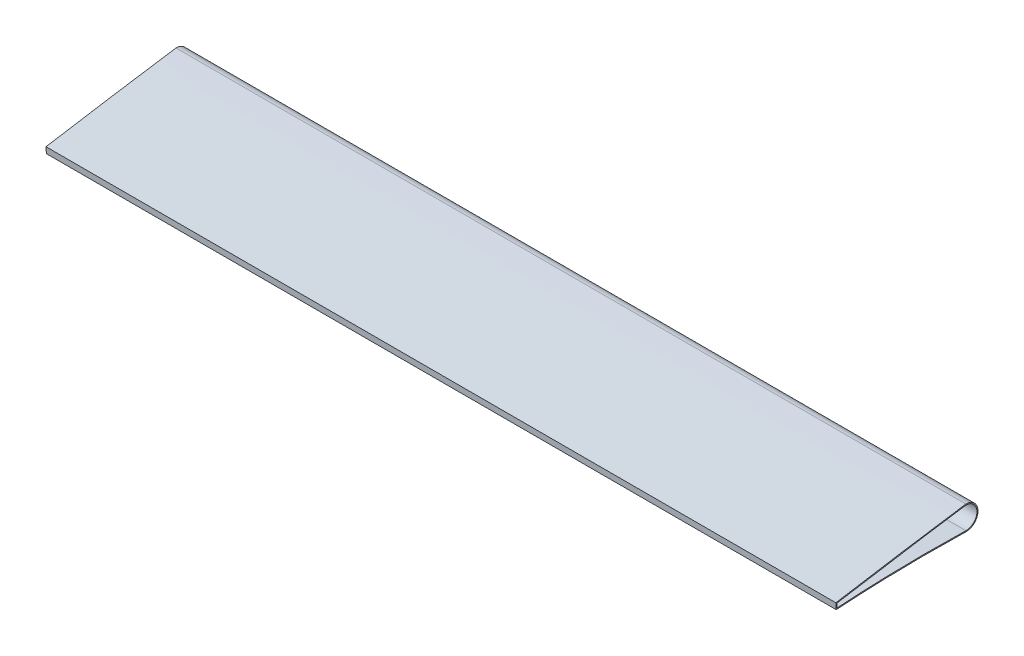
from build123d import *

# Parameters (mm, degrees)
SCHIZZO1_R               = 1.65
CORPOFOAM_DEPTH          = 225
SCHIZZO4_R               = 1.65
CORPOCENTINA_DEPTH       = 5
RIMOZIONEFOAM_DEPTH      = 337.437145013
INTAGLIOPOSTERIORE_DEPTH = 251.179840316
RIVESTIMENTO_DEPTH       = 225
RIMOZIONECENTINA_DEPTH   = 331.394548547


with BuildPart() as part:
    # Schizzo1 → CorpoFoam (new body)
    with BuildSketch(Plane(origin=(0, 0, 0), x_dir=(0, 0, -1), z_dir=(1, 0, 0))):
        with BuildLine():
            ThreePointArc((-200, 8.059305289), (-196.8581753, 4.91748059), (-200, 1.77565589))
            add(Edge.make_bspline(
                [(-200, 8.059305289), (-202.187379866, 7.739758676), (-207.50572073, 6.94925042), (-215.560350587, 5.731221771), (-223.977157043, 4.293295131), (-231.363413337, 3.181808879), (-237.746440905, 2.098942424), (-242.622069367, 1.245861924), (-246.644529334, 0.552864955), (-248.328398442, 0.246216773), (-250.427328459, -0.052966692), (-248.284955517, 0.172375667), (-246.518112421, 0.308690023), (-242.189387345, 0.685693601), (-236.806461265, 1.074101535), (-229.680385953, 1.497317245), (-221.184158699, 1.823218606), (-211.337618209, 1.967626103), (-204.130566759, 1.879296162), (-200.224163887, 1.781432917), (-200, 1.77565589)],
                knots=[0.90015767, 0.90015767, 0.90015767, 0.90015767, 0.913230871, 0.931955467, 0.948342069, 0.963693004, 0.976235918, 0.986320059, 0.993788799, 0.998424035, 1, 1.001588889, 1.006329218, 1.014202456, 1.025172808, 1.039173483, 1.056060631, 1.075578924, 1.097363607, 1.098689812, 1.098689812, 1.098689812, 1.098689812], degree=3))
        make_face()
        with Locations((-200, 4.91748059)):
            Circle(SCHIZZO1_R, mode=Mode.SUBTRACT)
    extrude(amount=CORPOFOAM_DEPTH)

    # Schizzo6 → RimozioneFoam (cut, through all)
    with BuildSketch(Plane.ZY):
        with BuildLine():
            ThreePointArc((200, 8.05930529), (196.8581753, 4.91748059), (200, 1.77565589))
            add(Edge.make_bspline(
                [(200, 1.77565589), (200.224163887, 1.781432917), (204.130566759, 1.879296162), (211.337618209, 1.967626103), (221.184158699, 1.823218606), (229.680385953, 1.497317245), (236.806461265, 1.074101535), (242.189387345, 0.685693601), (246.518112421, 0.308690023), (248.284955517, 0.172375667), (250.427328459, -0.052966692), (248.328398442, 0.246216773), (246.644529334, 0.552864955), (242.622069367, 1.245861924), (237.746440905, 2.098942424), (231.363413337, 3.181808879), (223.977157043, 4.293295131), (215.560350587, 5.731221771), (207.50572073, 6.94925042), (202.187379866, 7.739758676), (200, 8.05930529)],
                knots=[0.90015767, 0.90015767, 0.90015767, 0.90015767, 0.901483875, 0.923268558, 0.942786851, 0.959673998, 0.973674674, 0.984645025, 0.992518264, 0.997258593, 0.998847482, 1.000423447, 1.005058682, 1.012527423, 1.022611563, 1.035154477, 1.050505413, 1.066892015, 1.085616611, 1.098689812, 1.098689812, 1.098689812, 1.098689812], degree=3))
        make_face()
    extrude(amount=-RIMOZIONEFOAM_DEPTH, mode=Mode.SUBTRACT)


with BuildPart() as body_2:
    # Schizzo4 → CorpoCentina (new body)
    with BuildSketch(Plane.ZY.offset(15)):
        with BuildLine():
            ThreePointArc((200, 8.05930529), (196.8581753, 4.91748059), (200, 1.77565589))
            add(Edge.make_bspline(
                [(200, 1.77565589), (200.224163887, 1.781432917), (204.130566759, 1.879296162), (211.337618209, 1.967626103), (221.184158699, 1.823218606), (229.680385953, 1.497317245), (236.806461265, 1.074101535), (242.189387345, 0.685693601), (246.518112421, 0.308690023), (248.284955517, 0.172375667), (250.427328459, -0.052966692), (248.328398442, 0.246216773), (246.644529334, 0.552864955), (242.622069367, 1.245861924), (237.746440905, 2.098942424), (231.363413337, 3.181808879), (223.977157043, 4.293295131), (215.560350587, 5.731221771), (207.50572073, 6.94925042), (202.187379866, 7.739758676), (200, 8.05930529)],
                knots=[0.90015767, 0.90015767, 0.90015767, 0.90015767, 0.901483875, 0.923268558, 0.942786851, 0.959673998, 0.973674674, 0.984645025, 0.992518264, 0.997258593, 0.998847482, 1.000423447, 1.005058682, 1.012527423, 1.022611563, 1.035154477, 1.050505413, 1.066892015, 1.085616611, 1.098689812, 1.098689812, 1.098689812, 1.098689812], degree=3))
        make_face()
        with Locations((200, 4.91748059)):
            Circle(SCHIZZO4_R, mode=Mode.SUBTRACT)
    extrude(amount=CORPOCENTINA_DEPTH)

    # Schizzo7 → IntaglioPosteriore (cut, through all)
    with BuildSketch(Plane.ZY.offset(20)):
        with BuildLine():
            Line((294.445512703, 22.425455209), (238.029690152, 25.569085055))
            Line((238.029690152, 25.569085055), (236.731303845, 2.268144705))
            add(Edge.make_bspline(
                [(236.664540432, 1.070003375), (236.86754193, 1.056774279), (238.902160272, 0.922885243), (242.189387345, 0.685693601), (246.518112421, 0.308690023), (248.284955517, 0.172375667), (250.427328459, -0.052966692), (248.328398442, 0.246216773), (246.644529334, 0.552864955), (242.622069367, 1.245861924), (239.325840074, 1.822597612), (237.195098996, 2.188855706), (236.731303845, 2.268144705)],
                knots=[0.972461039, 0.972461039, 0.972461039, 0.972461039, 0.973674674, 0.984645025, 0.992518264, 0.997258593, 0.998847482, 1.000423447, 1.005058682, 1.012527423, 1.022611563, 1.025405319, 1.025405319, 1.025405319, 1.025405319], degree=3))
            Line((236.664540432, 1.070003375), (235.367531701, -22.206214878))
            Line((235.367531701, -22.206214878), (291.783354252, -25.349844724))
            Line((291.783354252, -25.349844724), (294.445512703, 22.425455209))
        make_face()
        with BuildLine():
            add(Edge.make_bspline(
                [(236.664540432, 1.070003375), (236.86754193, 1.056774279), (238.902160272, 0.922885243), (242.189387345, 0.685693601), (246.518112421, 0.308690023), (248.284955517, 0.172375667), (250.427328459, -0.052966692), (248.328398442, 0.246216773), (246.644529334, 0.552864955), (242.622069367, 1.245861924), (239.325840074, 1.822597612), (237.195098996, 2.188855706), (236.731303845, 2.268144705)],
                knots=[0.972461039, 0.972461039, 0.972461039, 0.972461039, 0.973674674, 0.984645025, 0.992518264, 0.997258593, 0.998847482, 1.000423447, 1.005058682, 1.012527423, 1.022611563, 1.025405319, 1.025405319, 1.025405319, 1.025405319], degree=3))
            Line((236.731303845, 2.268144705), (236.664540432, 1.070003375))
        make_face()
    extrude(amount=-INTAGLIOPOSTERIORE_DEPTH, mode=Mode.SUBTRACT)

    # Schizzo9 → RimozioneCentina (cut, through all)
    with BuildSketch(Plane(origin=(-15, 0, 0), x_dir=(0, 0, -1), z_dir=(1, 0, 0))):
        with BuildLine():
            Line((-236.731303845, 2.268144705), (-236.664540432, 1.070003375))
            add(Edge.make_bspline(
                [(-236.664540432, 1.070003375), (-234.525686034, 1.209387124), (-229.475821131, 1.505164017), (-221.184158699, 1.823218606), (-211.337618209, 1.967626103), (-204.130566759, 1.879296162), (-200.224163887, 1.781432917), (-200, 1.77565589)],
                knots=[0.90015767, 0.90015767, 0.90015767, 0.90015767, 0.91294471, 0.929831858, 0.949350151, 0.971134834, 0.972461039, 0.972461039, 0.972461039, 0.972461039], degree=3))
            ThreePointArc((-200, 1.77565589), (-196.8581753, 4.91748059), (-200, 8.05930529))
            add(Edge.make_bspline(
                [(-200, 8.05930529), (-202.187379866, 7.739758676), (-207.50572073, 6.94925042), (-215.560350587, 5.731221771), (-223.977157043, 4.293295131), (-230.897397414, 3.251935107), (-235.112832905, 2.544833541), (-236.731303845, 2.268144705)],
                knots=[1.025405319, 1.025405319, 1.025405319, 1.025405319, 1.03847852, 1.057203116, 1.073589718, 1.088940654, 1.098689812, 1.098689812, 1.098689812, 1.098689812], degree=3))
        make_face()
    extrude(amount=-RIMOZIONECENTINA_DEPTH, mode=Mode.SUBTRACT)


with BuildPart() as body_2_2:
    # Schizzo8 → Rivestimento (new body)
    with BuildSketch(Plane.ZY.offset(20)):
        with BuildLine():
            Line((236.9472271, 0.750945052), (237.045733203, 2.518743194))
            add(Edge.make_bspline(
                [(237.045733203, 2.518743194), (233.962351817, 3.045868634), (229.318057474, 3.788568713), (223.16497239, 4.745456415), (217.006036982, 5.783792258), (209.288425538, 6.994443084), (203.112011401, 7.907866804), (200.022291432, 8.359233102)],
                knots=[1.024875484, 1.024875484, 1.024875484, 1.024875484, 1.043339562, 1.052571601, 1.06180364, 1.080267718, 1.098731796, 1.098731796, 1.098731796, 1.098731796], degree=3))
            ThreePointArc((200.022291432, 8.359233102), (196.558187514, 4.92664979), (200.003953165, 1.47565816))
            add(Edge.make_bspline(
                [(200.003953165, 1.47565816), (203.082868041, 1.555006238), (209.239827337, 1.652940438), (218.492401608, 1.584321304), (226.161726594, 1.346122551), (232.348041607, 1.039634714), (235.412171703, 0.850980742), (236.9472271, 0.750945052)],
                knots=[0.900150224, 0.900150224, 0.900150224, 0.900150224, 0.918378483, 0.936606742, 0.954835001, 0.96394913, 0.97306326, 0.97306326, 0.97306326, 0.97306326], degree=3))
        make_face()
        with BuildLine():
            Line((236.664540434, 1.070003375), (236.731303845, 2.268144703))
            add(Edge.make_bspline(
                [(236.731303845, 2.268144703), (235.112832905, 2.544833541), (230.897397414, 3.251935107), (223.977157043, 4.293295131), (215.560350587, 5.731221771), (207.50572073, 6.94925042), (202.187379866, 7.739758676), (200, 8.05930529)],
                knots=[1.025405319, 1.025405319, 1.025405319, 1.025405319, 1.035154477, 1.050505413, 1.066892015, 1.085616611, 1.098689812, 1.098689812, 1.098689812, 1.098689812], degree=3))
            ThreePointArc((200, 8.05930529), (196.8581753, 4.91748059), (200, 1.77565589))
            add(Edge.make_bspline(
                [(200, 1.77565589), (200.224163887, 1.781432917), (204.130566759, 1.879296162), (211.337618209, 1.967626103), (221.184158699, 1.823218606), (229.475821132, 1.505164017), (234.525686035, 1.209387123), (236.664540434, 1.070003375)],
                knots=[0.90015767, 0.90015767, 0.90015767, 0.90015767, 0.901483875, 0.923268558, 0.942786851, 0.959673998, 0.972461039, 0.972461039, 0.972461039, 0.972461039], degree=3))
        make_face(mode=Mode.SUBTRACT)
    extrude(amount=RIVESTIMENTO_DEPTH)


solid = body_2_2.part
